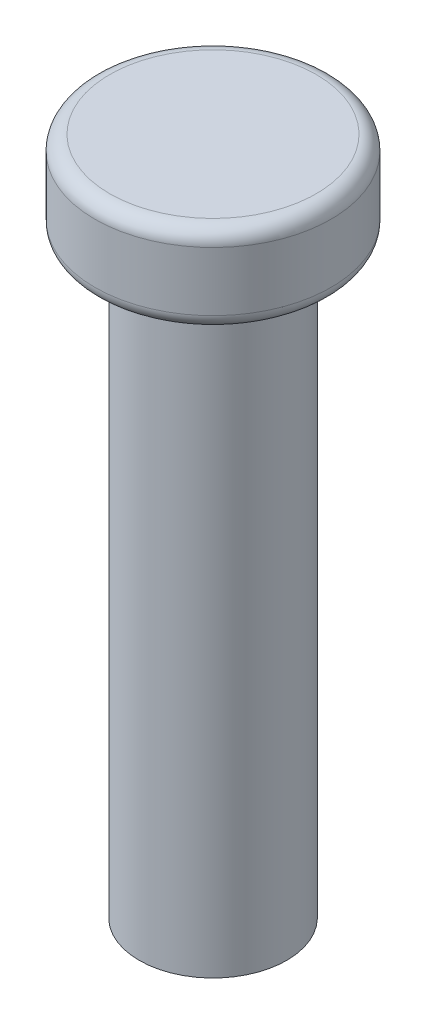
from build123d import *

# Parameters (mm, degrees)
SKETCH1_R           = 2.5
BOSS_EXTRUDE1_DEPTH = 20
SKETCH2_R           = 4
BOSS_EXTRUDE2_DEPTH = 3
FILLET1_R           = 0.5
FILLET2_R           = 0.5


with BuildPart() as part:
    # Sketch1 → Boss-Extrude1 (new body)
    with BuildSketch(Plane(origin=(0, 0, 0), x_dir=(1, 0, 0), z_dir=(0, 1, 0))):
        with Locations(Location((0, 0, 0), (0, 0, 270))):
            Circle(SKETCH1_R)
    extrude(amount=BOSS_EXTRUDE1_DEPTH)

    # Sketch2 → Boss-Extrude2 (add)
    with BuildSketch(Plane(origin=(0, 20, 0), x_dir=(1, 0, 0), z_dir=(0, 1, 0))):
        with Locations(Location((0, 0, 0), (0, 0, 270))):
            Circle(SKETCH2_R)
    extrude(amount=BOSS_EXTRUDE2_DEPTH)

    # Fillet1
    fillet1_edges = [part.edges().sort_by_distance(p)[0] for p in [
        (0, 23, -4),
    ]]
    fillet(fillet1_edges, radius=FILLET1_R)

    # Fillet2
    fillet2_edges = [part.edges().sort_by_distance(p)[0] for p in [
        (0, 20, -4),
    ]]
    fillet(fillet2_edges, radius=FILLET2_R)


solid = part.part
